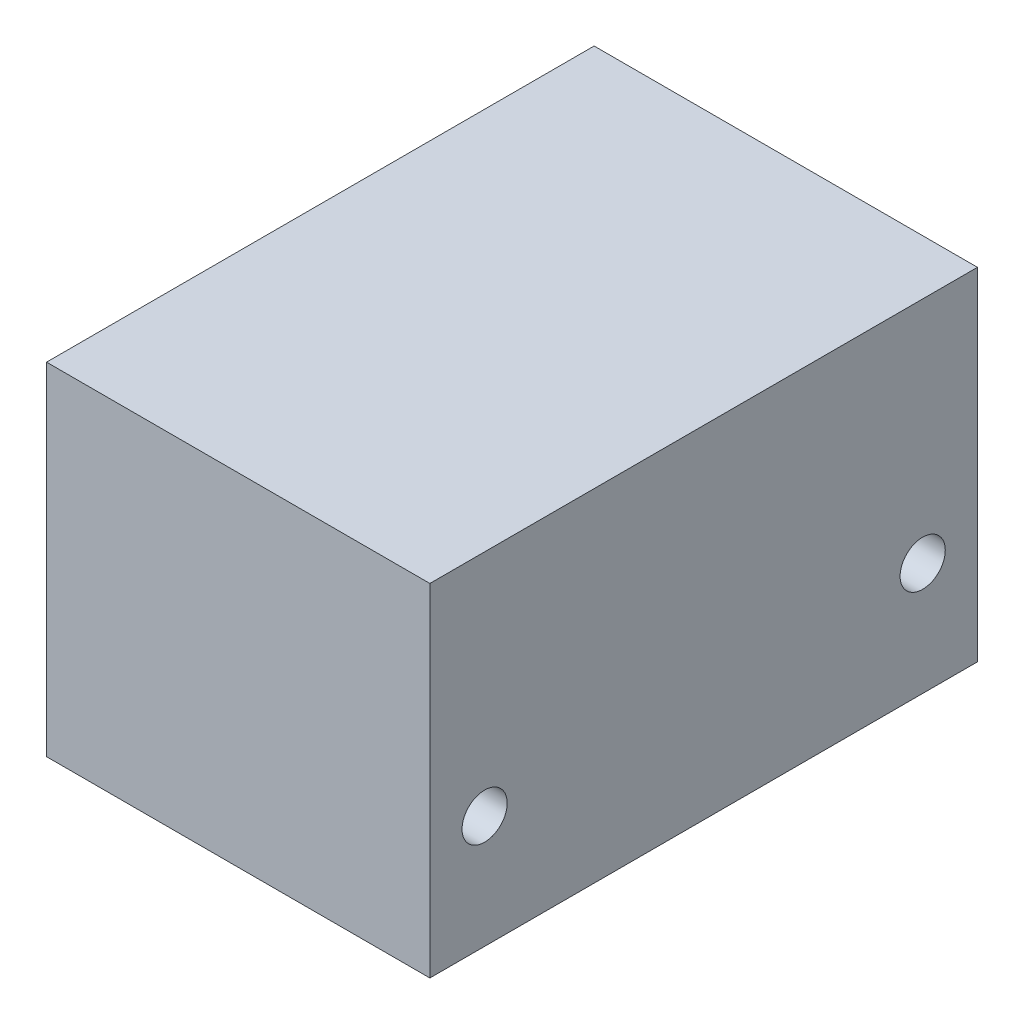
from build123d import *

# Parameters (mm, degrees)
SKETCH1_W           = 14
SKETCH1_H           = 20
BOSS_EXTRUDE1_DEPTH = 13.98
SKETCH2_R           = 0.825
CUT_EXTRUDE1_DEPTH  = 23.168455066
SKETCH6_W           = 14
SKETCH6_H           = 20
CUT_EXTRUDE2_DEPTH  = 1.5
SKETCH7_R           = 4.55
BOSS_EXTRUDE2_DEPTH = 1.5


with BuildPart() as part:
    # Sketch1 → Boss-Extrude1 (new body)
    with BuildSketch(Plane(origin=(0, 0, 0), x_dir=(1, 0, 0), z_dir=(0, 1, 0))):
        Rectangle(SKETCH1_W, SKETCH1_H)
    extrude(amount=BOSS_EXTRUDE1_DEPTH)

    # Sketch2 → Cut-Extrude1 (cut, through all)
    with BuildSketch(Plane(origin=(7, 0, 0), x_dir=(0, 0, -1), z_dir=(1, 0, 0))):
        with Locations((8, 5.62)):
            Circle(SKETCH2_R)
        with Locations((-8, 5.62)):
            Circle(SKETCH2_R)
    extrude(amount=-CUT_EXTRUDE1_DEPTH, mode=Mode.SUBTRACT)

    # Sketch6 → Cut-Extrude2 (cut)
    with BuildSketch(Plane.XZ):
        Rectangle(SKETCH6_W, SKETCH6_H)
    extrude(amount=-CUT_EXTRUDE2_DEPTH, mode=Mode.SUBTRACT)

    # Sketch7 → Boss-Extrude2 (add)
    with BuildSketch(Plane.XZ.offset(-1.5)):
        with Locations(Location((0, 0, 0), (0, 0, 270))):
            Circle(SKETCH7_R)
    extrude(amount=BOSS_EXTRUDE2_DEPTH)


solid = part.part
